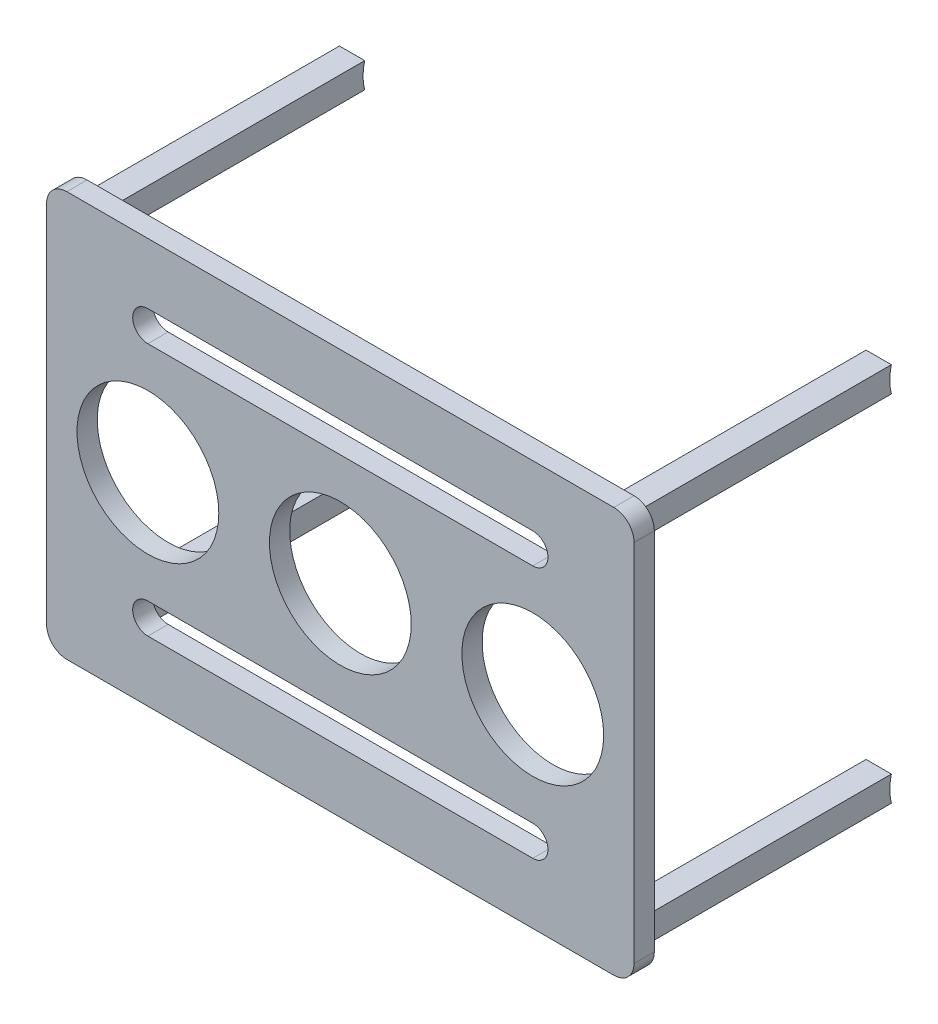
from build123d import *

# Parameters (mm, degrees)
SKETCH1_W           = 58
SKETCH1_H           = 40
BOSS_EXTRUDE2_DEPTH = 2
SKETCH2_R           = 7
CUT_EXTRUDE1_DEPTH  = 2
FILLET1_R           = 2
SKETCH4_R           = 2.5
CUT_EXTRUDE5_DEPTH  = 2
SKETCH6_R           = 2.5
BOSS_EXTRUDE3_DEPTH = 2
SKETCH7_W           = 2.5
SKETCH7_H           = 2.5
BOSS_EXTRUDE5_DEPTH = 30
SKETCH8_R           = 5
CUT_EXTRUDE6_DEPTH  = 66


with BuildPart() as part:
    # Sketch1 → Boss-Extrude2 (new body)
    with BuildSketch(Plane.XY):
        Rectangle(SKETCH1_W, SKETCH1_H)
    extrude(amount=BOSS_EXTRUDE2_DEPTH)

    # Sketch2 → Cut-Extrude1 (cut)
    with BuildSketch(Plane.XY.offset(2)):
        Circle(SKETCH2_R)
        with Locations((19, 0)):
            Circle(SKETCH2_R)
        with Locations((-19, 0)):
            Circle(SKETCH2_R)
        with BuildLine():
            Line((-19, 13.999747299), (19, 13.999747299))
            ThreePointArc((19, 13.999747299), (20.499747299, 12.5), (19, 11.000252701))
            Line((19, 11.000252701), (-19, 11.000252701))
            ThreePointArc((-19, 11.000252701), (-20.499747299, 12.5), (-19, 13.999747299))
        make_face()
        with BuildLine():
            Line((-19, -10.99999193), (19, -10.99999193))
            ThreePointArc((19, -10.99999193), (20.50000807, -12.5), (19, -14.00000807))
            Line((19, -14.00000807), (-19, -14.00000807))
            ThreePointArc((-19, -14.00000807), (-20.50000807, -12.5), (-19, -10.99999193))
        make_face()
    extrude(amount=-CUT_EXTRUDE1_DEPTH, mode=Mode.SUBTRACT)

    # Fillet1
    fillet1_edges = [part.edges().sort_by_distance(p)[0] for p in [
        (29, -20, 1),
        (-29, -20, 1),
        (-29, 20, 1),
        (29, 20, 1),
    ]]
    fillet(fillet1_edges, radius=FILLET1_R)

    # Sketch4 → Cut-Extrude5 (cut)
    with BuildSketch(Plane(origin=(0, 0, 0), x_dir=(-1, 0, 0), z_dir=(0, 0, -1))):
        with Locations((25.5, 12.5)):
            Circle(SKETCH4_R)
        with Locations(Location((25.5, -12.5, 0), (0, 0, 180))):
            Circle(SKETCH4_R)
        with Locations((-25.5, -12.5)):
            Circle(SKETCH4_R)
        with Locations(Location((-25.5, 12.5, 0), (0, 0, 180))):
            Circle(SKETCH4_R)
    extrude(amount=-CUT_EXTRUDE5_DEPTH, mode=Mode.SUBTRACT)

    # Sketch6 → Boss-Extrude3 (add)
    with BuildSketch(Plane(origin=(0, 0, 0), x_dir=(-1, 0, 0), z_dir=(0, 0, -1))):
        with Locations((25.5, 12.5)):
            Circle(SKETCH6_R)
        with Locations((25.5, -12.5)):
            Circle(SKETCH6_R)
        with Locations((-25.5, -12.5)):
            Circle(SKETCH6_R)
        with Locations((-25.5, 12.5)):
            Circle(SKETCH6_R)
    extrude(amount=-BOSS_EXTRUDE3_DEPTH)

    # Sketch7 → Boss-Extrude5 (add)
    with BuildSketch(Plane(origin=(0, 0, 0), x_dir=(-1, 0, 0), z_dir=(0, 0, -1))):
        with Locations((-26, 17.5)):
            Rectangle(SKETCH7_W, SKETCH7_H)
        with Locations((-26, -17.5)):
            Rectangle(SKETCH7_W, SKETCH7_H)
        with Locations((26, -17.5)):
            Rectangle(SKETCH7_W, SKETCH7_H)
        with Locations((26, 17.5)):
            Rectangle(SKETCH7_W, SKETCH7_H)
    extrude(amount=BOSS_EXTRUDE5_DEPTH)

    # Sketch8 → Cut-Extrude6 (cut)
    with BuildSketch(Plane.ZY.offset(27.25)):
        with Locations((-30, 17.5)):
            Circle(SKETCH8_R)
        with Locations((-30, -17.5)):
            Circle(SKETCH8_R)
    extrude(amount=-CUT_EXTRUDE6_DEPTH, mode=Mode.SUBTRACT)


solid = part.part
